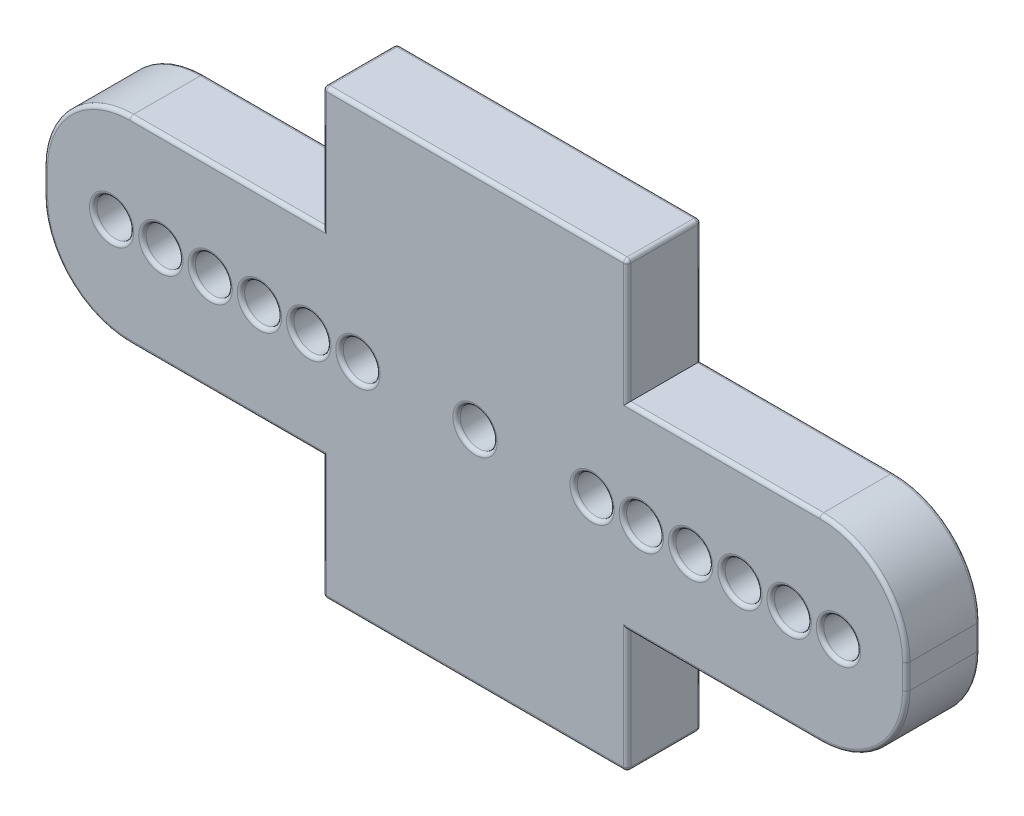
from build123d import *

# Parameters (mm, degrees)
SKETCH1_R           = 0.75
BOSS_EXTRUDE1_DEPTH = 1.5
SKETCH2_R           = 0.75
CUT_EXTRUDE1_DEPTH  = 20.906029237
FILLET2_R           = 0.15


with BuildPart() as part:
    # Sketch1 → Boss-Extrude1 (new, symmetric)
    with BuildSketch(Plane.XY):
        with BuildLine():
            Line((-14, 4), (-6.175, 4))
            Line((-6.175, 4), (-6.175, 9))
            Line((-6.175, 9), (6.175, 9))
            Line((6.175, 9), (6.175, 4))
            Line((6.175, 4), (14, 4))
            ThreePointArc((14, 4), (16.474873734, 2.974873734), (17.5, 0.5))
            Line((17.5, 0.5), (17.5, -0.5))
            ThreePointArc((17.5, -0.5), (16.474873734, -2.974873734), (14, -4))
            Line((14, -4), (6.175, -4))
            Line((6.175, -4), (6.175, -9))
            Line((6.175, -9), (-6.175, -9))
            Line((-6.175, -9), (-6.175, -4))
            Line((-6.175, -4), (-14, -4))
            ThreePointArc((-14, -4), (-16.474873734, -2.974873734), (-17.5, -0.5))
            Line((-17.5, -0.5), (-17.5, 0.5))
            ThreePointArc((-17.5, 0.5), (-16.474873734, 2.974873734), (-14, 4))
        make_face()
        Circle(SKETCH1_R, mode=Mode.SUBTRACT)
    extrude(amount=BOSS_EXTRUDE1_DEPTH, both=True)

    # Sketch2 → Cut-Extrude1 (cut, through all)
    with BuildSketch(Plane.XY.offset(1.5)):
        with Locations((-14.75, 0)):
            Circle(SKETCH2_R)
        with Locations((-12.75, 0)):
            Circle(SKETCH2_R)
        with Locations((-10.75, 0)):
            Circle(SKETCH2_R)
        with Locations((-8.75, 0)):
            Circle(SKETCH2_R)
        with Locations((-6.75, 0)):
            Circle(SKETCH2_R)
        with Locations((-4.75, 0)):
            Circle(SKETCH2_R)
    cut_extrude1 = extrude(amount=-CUT_EXTRUDE1_DEPTH, mode=Mode.SUBTRACT)

    # Mirror1: Cut-Extrude1 across plane
    add(cut_extrude1.mirror(Plane(origin=(0, 0, 0), x_dir=(0, 0, 1), z_dir=(1, 0, 0))), mode=Mode.SUBTRACT)

    # Fillet2
    fillet2_edges = [part.edges().sort_by_distance(p)[0] for p in [
        (-10.0875, 4, 1.5),
        (-16.474873734, 2.974873734, 1.5),
        (6.175, 6.5, -1.5),
        (10.0875, 4, -1.5),
        (16.474873734, 2.974873734, -1.5),
        (17.5, 0, -1.5),
        (16.474873734, -2.974873734, -1.5),
        (-17.5, 0, 1.5),
        (10.0875, -4, -1.5),
        (6.175, -6.5, -1.5),
        (0, -9, -1.5),
        (-6.175, -6.5, -1.5),
        (-10.0875, -4, -1.5),
        (-16.474873734, -2.974873734, -1.5),
        (-17.5, 0, -1.5),
        (-16.474873734, 2.974873734, -1.5),
        (-16.474873734, -2.974873734, 1.5),
        (-10.0875, 4, -1.5),
        (-6.175, 6.5, -1.5),
        (0, 9, -1.5),
        (-10.0875, -4, 1.5),
        (-6.175, -6.5, 1.5),
        (6.175, 9, 0),
        (6.175, -9, 0),
        (-6.175, -9, 0),
        (-6.175, 9, 0),
        (0, -9, 1.5),
        (6.175, -6.5, 1.5),
        (10.0875, -4, 1.5),
        (16.474873734, -2.974873734, 1.5),
        (-0.75, 0, -1.5),
        (-0.75, 0, 1.5),
        (0, 9, 1.5),
        (17.5, 0, 1.5),
        (16.474873734, 2.974873734, 1.5),
        (10.0875, 4, 1.5),
        (6.175, 6.5, 1.5),
        (-15.5, 0, -1.5),
        (-15.5, 0, 1.5),
        (-13.5, 0, -1.5),
        (-13.5, 0, 1.5),
        (-11.5, 0, -1.5),
        (-11.5, 0, 1.5),
        (-9.5, 0, -1.5),
        (-9.5, 0, 1.5),
        (-7.5, 0, -1.5),
        (-7.5, 0, 1.5),
        (-5.5, 0, -1.5),
        (-5.5, 0, 1.5),
        (-6.175, 6.5, 1.5),
        (15.5, 0, 1.5),
        (15.5, 0, -1.5),
        (13.5, 0, 1.5),
        (13.5, 0, -1.5),
        (11.5, 0, 1.5),
        (11.5, 0, -1.5),
        (9.5, 0, 1.5),
        (9.5, 0, -1.5),
        (7.5, 0, 1.5),
        (7.5, 0, -1.5),
        (5.5, 0, 1.5),
        (5.5, 0, -1.5),
    ]]
    fillet(fillet2_edges, radius=FILLET2_R)


solid = part.part
